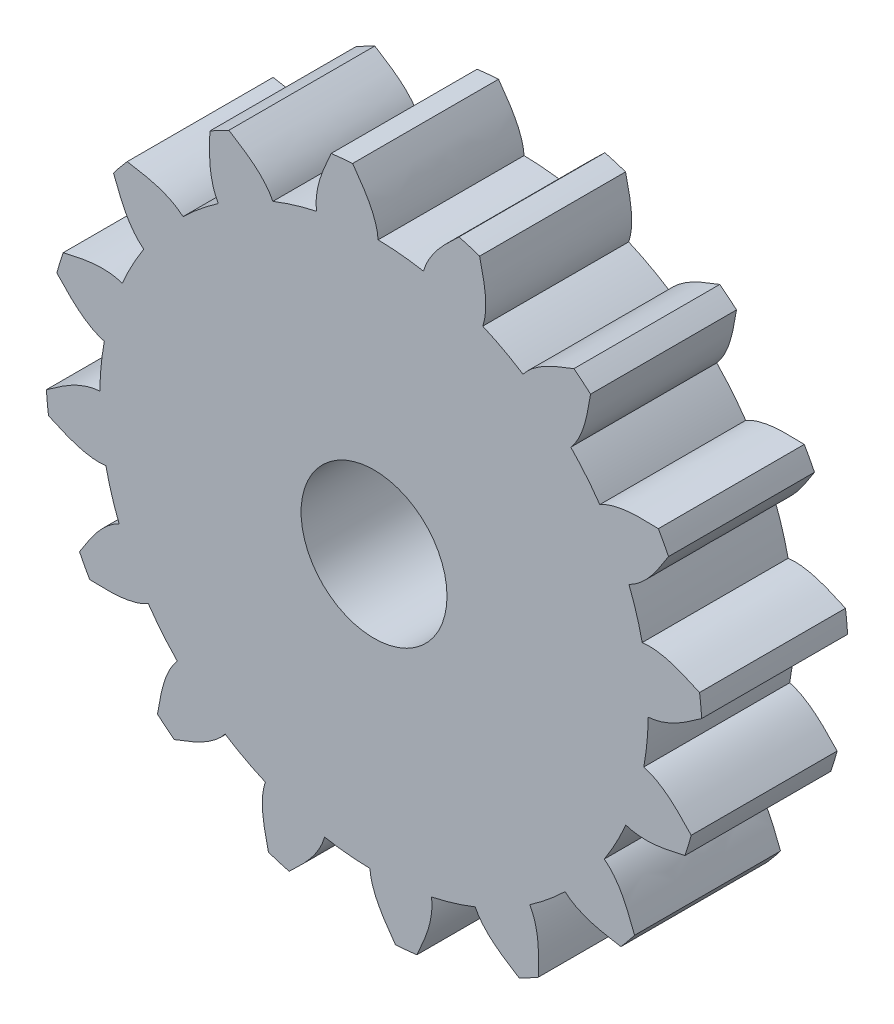
from build123d import *

# Parameters (mm, degrees)
BOSS_EXTRUDE7_DEPTH = 1
CIRPATTERN1_COUNT   = 16
DIAMETRO_BASE_R     = 1.879385242
BOSS_EXTRUDE9_DEPTH = 1
MOZZO_R             = 0.5
CUT_EXTRUDE1_DEPTH  = 1


with BuildPart() as part:
    # profilo → Boss-Extrude7 (new body)
    with BuildSketch(Plane.XY):
        with BuildLine():
            Line((-0.220538566, 2.239165635), (-0.184211967, 1.870335488))
            ThreePointArc((-0.184211967, 1.870335488), (-0.078225963, 1.87775653), (0.028010042, 1.879176501))
            add(Edge.make_bspline(
                [(-0.14670524, 2.245212144), (-0.068888242, 2.136288179), (0.01902302, 2.014536344), (0.028010042, 1.879176501)],
                knots=[0.201514188, 0.201514188, 0.201514188, 0.201514188, 1, 1, 1, 1], degree=3))
            ThreePointArc((-0.14670524, 2.245212144), (-0.18364679, 2.242492777), (-0.220538566, 2.239165635))
        make_face()
    extrude(amount=BOSS_EXTRUDE7_DEPTH)

    # Mirror1: part across plane


with BuildPart() as part_1:
    add(part.part)
    add(part.part.mirror(Plane(origin=(0, 0, 0), x_dir=(0, 0, 1), z_dir=(0.9951847266721969, 0.09801714032956142, 0))))


with BuildPart() as cirpattern1_1:
    # CirPattern1: pattern copy
    add(part_1.part.rotate(Axis((0, 0, 1), (0, 0, 1)), 1 * 360 / CIRPATTERN1_COUNT))


with BuildPart() as cirpattern1_2:
    # CirPattern1: pattern copy
    add(part_1.part.rotate(Axis((0, 0, 1), (0, 0, 1)), 2 * 360 / CIRPATTERN1_COUNT))


with BuildPart() as cirpattern1_3:
    # CirPattern1: pattern copy
    add(part_1.part.rotate(Axis((0, 0, 1), (0, 0, 1)), 3 * 360 / CIRPATTERN1_COUNT))


with BuildPart() as cirpattern1_4:
    # CirPattern1: pattern copy
    add(part_1.part.rotate(Axis((0, 0, 1), (0, 0, 1)), 4 * 360 / CIRPATTERN1_COUNT))


with BuildPart() as cirpattern1_5:
    # CirPattern1: pattern copy
    add(part_1.part.rotate(Axis((0, 0, 1), (0, 0, 1)), 5 * 360 / CIRPATTERN1_COUNT))


with BuildPart() as cirpattern1_6:
    # CirPattern1: pattern copy
    add(part_1.part.rotate(Axis((0, 0, 1), (0, 0, 1)), 6 * 360 / CIRPATTERN1_COUNT))


with BuildPart() as cirpattern1_7:
    # CirPattern1: pattern copy
    add(part_1.part.rotate(Axis((0, 0, 1), (0, 0, 1)), 7 * 360 / CIRPATTERN1_COUNT))


with BuildPart() as cirpattern1_8:
    # CirPattern1: pattern copy
    add(part_1.part.rotate(Axis((0, 0, 1), (0, 0, 1)), 8 * 360 / CIRPATTERN1_COUNT))


with BuildPart() as cirpattern1_9:
    # CirPattern1: pattern copy
    add(part_1.part.rotate(Axis((0, 0, 1), (0, 0, 1)), 9 * 360 / CIRPATTERN1_COUNT))


with BuildPart() as cirpattern1_10:
    # CirPattern1: pattern copy
    add(part_1.part.rotate(Axis((0, 0, 1), (0, 0, 1)), 10 * 360 / CIRPATTERN1_COUNT))


with BuildPart() as cirpattern1_11:
    # CirPattern1: pattern copy
    add(part_1.part.rotate(Axis((0, 0, 1), (0, 0, 1)), 11 * 360 / CIRPATTERN1_COUNT))


with BuildPart() as cirpattern1_12:
    # CirPattern1: pattern copy
    add(part_1.part.rotate(Axis((0, 0, 1), (0, 0, 1)), 12 * 360 / CIRPATTERN1_COUNT))


with BuildPart() as cirpattern1_13:
    # CirPattern1: pattern copy
    add(part_1.part.rotate(Axis((0, 0, 1), (0, 0, 1)), 13 * 360 / CIRPATTERN1_COUNT))


with BuildPart() as cirpattern1_14:
    # CirPattern1: pattern copy
    add(part_1.part.rotate(Axis((0, 0, 1), (0, 0, 1)), 14 * 360 / CIRPATTERN1_COUNT))


with BuildPart() as cirpattern1_15:
    # CirPattern1: pattern copy
    add(part_1.part.rotate(Axis((0, 0, 1), (0, 0, 1)), 15 * 360 / CIRPATTERN1_COUNT))


with BuildPart() as part_2:
    add(part_1.part)

    add(cirpattern1_1.part)  # Boss-Extrude9 merges CirPattern1_1

    add(cirpattern1_2.part)  # Boss-Extrude9 merges CirPattern1_2

    add(cirpattern1_3.part)  # Boss-Extrude9 merges CirPattern1_3

    add(cirpattern1_4.part)  # Boss-Extrude9 merges CirPattern1_4

    add(cirpattern1_5.part)  # Boss-Extrude9 merges CirPattern1_5

    add(cirpattern1_6.part)  # Boss-Extrude9 merges CirPattern1_6

    add(cirpattern1_7.part)  # Boss-Extrude9 merges CirPattern1_7

    add(cirpattern1_8.part)  # Boss-Extrude9 merges CirPattern1_8

    add(cirpattern1_9.part)  # Boss-Extrude9 merges CirPattern1_9

    add(cirpattern1_10.part)  # Boss-Extrude9 merges CirPattern1_10

    add(cirpattern1_11.part)  # Boss-Extrude9 merges CirPattern1_11

    add(cirpattern1_12.part)  # Boss-Extrude9 merges CirPattern1_12

    add(cirpattern1_13.part)  # Boss-Extrude9 merges CirPattern1_13

    add(cirpattern1_14.part)  # Boss-Extrude9 merges CirPattern1_14

    add(cirpattern1_15.part)  # Boss-Extrude9 merges CirPattern1_15
    # diametro base → Boss-Extrude9 (add)
    with BuildSketch(Plane.XY):
        Circle(DIAMETRO_BASE_R)
    extrude(amount=BOSS_EXTRUDE9_DEPTH)

    # mozzo → Cut-Extrude1 (cut)
    with BuildSketch(Plane.XY):
        Circle(MOZZO_R)
    extrude(amount=CUT_EXTRUDE1_DEPTH, mode=Mode.SUBTRACT)


solid = part_2.part
